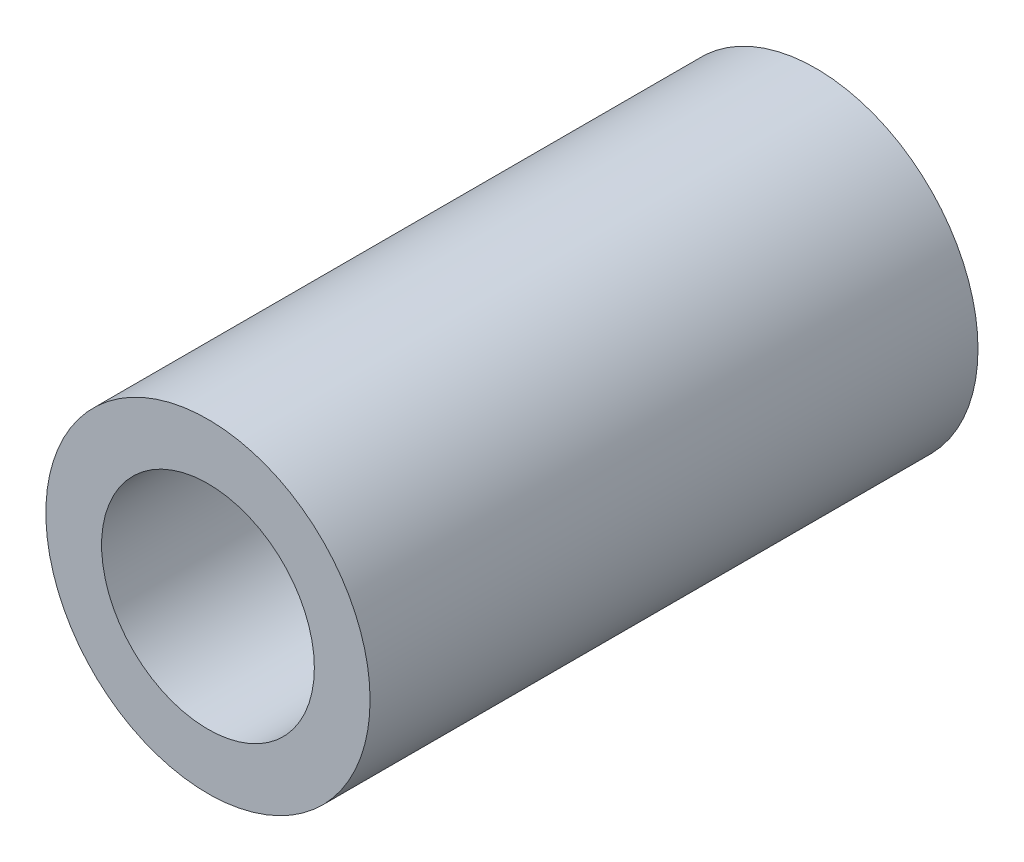
from build123d import *

# Parameters (mm, degrees)
SKETCH1_R           = 8
SKETCH1_R_2         = 5.25
BOSS_EXTRUDE1_DEPTH = 15


with BuildPart() as part:
    # Sketch1 → Boss-Extrude1 (new, symmetric)
    with BuildSketch(Plane.XY):
        Circle(SKETCH1_R)
        Circle(SKETCH1_R_2, mode=Mode.SUBTRACT)
    extrude(amount=BOSS_EXTRUDE1_DEPTH, both=True)


solid = part.part
